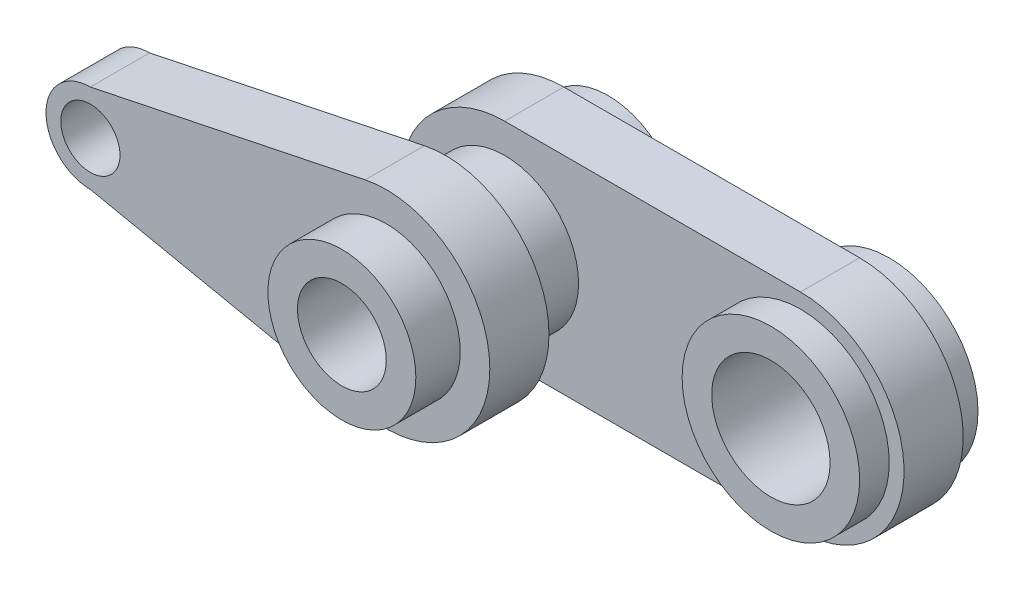
from build123d import *

# Parameters (mm, degrees)
SKETCH1_W                = 170
SKETCH1_H                = 70
BOSS_EXTRUDE1_DEPTH      = 10
FILLET1_RADIUS           = 35
FILLET1_LENGTH           = 20
FILLET2_RADIUS           = 35
FILLET2_LENGTH           = 20
BOSS_EXTRUDE2_DEPTH      = 10
BOSS_EXTRUDE2_DEPTH_BACK = 30
SKETCH2_R                = 30
BOSS_EXTRUDE3_DEPTH      = 20
BOSS_EXTRUDE3_DEPTH_BACK = 35
SKETCH3_R                = 25
SKETCH4_R                = 35
SKETCH4_R_2              = 25
BOSS_EXTRUDE4_DEPTH      = 20
SKETCH5_R                = 25
BOSS_EXTRUDE5_DEPTH      = 15
SKETCH6_R                = 10
SKETCH6_R_2              = 15
SKETCH6_R_3              = 20
CUT_EXTRUDE1_DEPTH       = 205.694894905


with BuildPart() as part:
    # Sketch1 → Boss-Extrude1 (new, symmetric)
    with BuildSketch(Plane.XY):
        with Locations((85, 35)):
            Rectangle(SKETCH1_W, SKETCH1_H)
    extrude(amount=BOSS_EXTRUDE1_DEPTH, both=True)

    # Fillet1: full round fillet: the end face becomes a half cylinder, R = half its width
    fillet1_face = Plane((170, 35, 0), x_dir=(0, 0, 1), z_dir=(1, 0, 0))  # on the end face: x along it, z out of the body
    fillet1_slab = fillet1_face.offset(-FILLET1_RADIUS / 2) * Box(FILLET1_LENGTH, 2 * FILLET1_RADIUS, FILLET1_RADIUS, mode=Mode.PRIVATE)  # the body's end, R deep
    fillet1_round = Plane((135, 35, 0), x_dir=(1, 0, 0), z_dir=(0, 0, 1)) * Cylinder(FILLET1_RADIUS, FILLET1_LENGTH, mode=Mode.PRIVATE)  # its axis R under the face
    add(fillet1_slab - fillet1_round, mode=Mode.SUBTRACT)

    # Fillet2: full round fillet: the end face becomes a half cylinder, R = half its width
    fillet2_face = Plane((0, 35, 0), x_dir=(0, 0, -1), z_dir=(-1, 0, 0))  # on the end face: x along it, z out of the body
    fillet2_slab = fillet2_face.offset(-FILLET2_RADIUS / 2) * Box(FILLET2_LENGTH, 2 * FILLET2_RADIUS, FILLET2_RADIUS, mode=Mode.PRIVATE)  # the body's end, R deep
    fillet2_round = Plane((35, 35, 0), x_dir=(-1, 0, 0), z_dir=(0, 0, -1)) * Cylinder(FILLET2_RADIUS, FILLET2_LENGTH, mode=Mode.PRIVATE)  # its axis R under the face
    add(fillet2_slab - fillet2_round, mode=Mode.SUBTRACT)

    # Sketch2 → Boss-Extrude2 (add, two sides: drawn at the far end of the back side and taken through both)
    with BuildSketch(Plane.XY.offset(10).offset(-BOSS_EXTRUDE2_DEPTH_BACK)):
        with Locations((135, 35)):
            Circle(SKETCH2_R)
    extrude(amount=BOSS_EXTRUDE2_DEPTH + BOSS_EXTRUDE2_DEPTH_BACK)

    # Sketch3 → Boss-Extrude3 (add, two sides: drawn at the far end of the back side and taken through both)
    with BuildSketch(Plane.XY.offset(10).offset(-BOSS_EXTRUDE3_DEPTH_BACK)):
        with Locations((35, 35)):
            Circle(SKETCH3_R)
    extrude(amount=BOSS_EXTRUDE3_DEPTH + BOSS_EXTRUDE3_DEPTH_BACK)


with BuildPart() as body_2:
    # Sketch4 → Boss-Extrude4 (new body)
    # profile 1 of 3: a face of its own
    with BuildSketch(Plane.XY.offset(30)):
        with BuildLine():
            ThreePointArc((-65, 50), (-80, 35), (-65, 20))
            Line((-65, 20), (27.890549941, 0.729667059))
            ThreePointArc((27.890549941, 0.729667059), (0, 35), (27.890549941, 69.270332941))
            Line((27.890549941, 69.270332941), (-65, 50))
        make_face()
    # profile 2 of 3: a face of its own
    with BuildSketch(Plane.XY.offset(30)):
        with Locations((35, 35)):
            Circle(SKETCH4_R)
        with Locations((35, 35)):
            Circle(SKETCH4_R_2, mode=Mode.SUBTRACT)
    # profile 3 of 3: a face of its own
    with BuildSketch(Plane.XY.offset(30)):
        with Locations((35, 35)):
            Circle(SKETCH4_R_2)
    extrude(amount=BOSS_EXTRUDE4_DEPTH)

    # Sketch5 → Boss-Extrude5 (add)
    with BuildSketch(Plane.XY.offset(50)):
        with Locations((35, 35)):
            Circle(SKETCH5_R)
    extrude(amount=BOSS_EXTRUDE5_DEPTH)


with BuildPart() as cut_extrude1_tool:
    # Sketch6 → Cut-Extrude1 (new, through all)
    with BuildSketch(Plane.XY.offset(65)):
        with Locations((-65, 35)):
            Circle(SKETCH6_R)
        with Locations((35, 35)):
            Circle(SKETCH6_R_2)
        with Locations((135, 35)):
            Circle(SKETCH6_R_3)
    extrude(amount=-CUT_EXTRUDE1_DEPTH)


with BuildPart() as part_1:
    add(part.part)

    # Cut-Extrude1: cut by cut_extrude1_tool
    add(cut_extrude1_tool.part, mode=Mode.SUBTRACT)


with BuildPart() as body_2_1:
    add(body_2.part)

    # Cut-Extrude1: cut by cut_extrude1_tool
    add(cut_extrude1_tool.part, mode=Mode.SUBTRACT)


solid = Compound([part_1.part, body_2_1.part])
